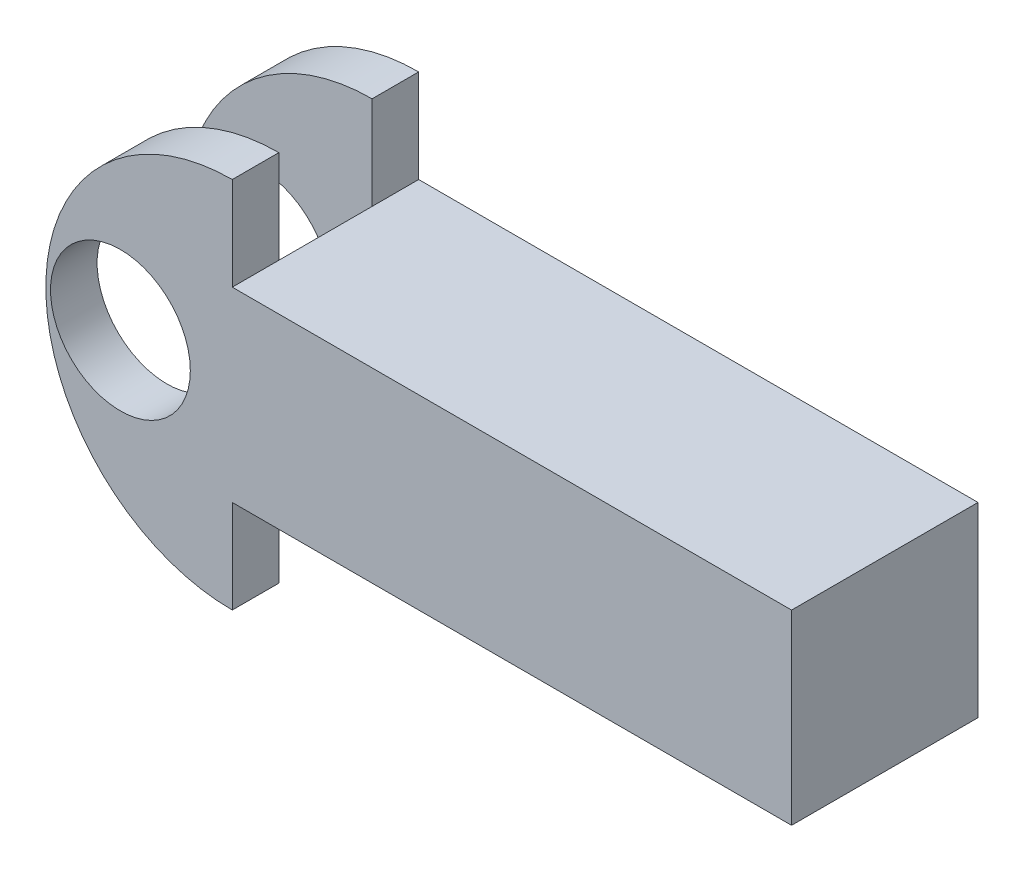
from build123d import *

# Parameters (mm, degrees)
SKETCH_1_W      = 60
SKETCH_1_H      = 20
EXTRUDE_1_DEPTH = 10
SKETCH_2_R      = 7.5
EXTRUDE_2_DEPTH = 5


with BuildPart() as part:
    # 草图1 → 凸台-拉伸1 (new, symmetric)
    with BuildSketch(Plane.XY):
        Rectangle(SKETCH_1_W, SKETCH_1_H)
    extrude(amount=EXTRUDE_1_DEPTH, both=True)

    # 草图2 → 凸台-拉伸2 (add)
    with BuildSketch(Plane.XY.offset(-5)):
        with BuildLine():
            Line((-30, 20), (-30, -20))
            ThreePointArc((-30, -20), (-50, 0), (-30, 20))
        make_face()
        with Locations((-42, 0)):
            Circle(SKETCH_2_R, mode=Mode.SUBTRACT)
    extrude_2 = extrude(amount=-EXTRUDE_2_DEPTH)

    # 镜向4: 凸台-拉伸2 across plane
    add(extrude_2.mirror(Plane.XY))


solid = part.part
